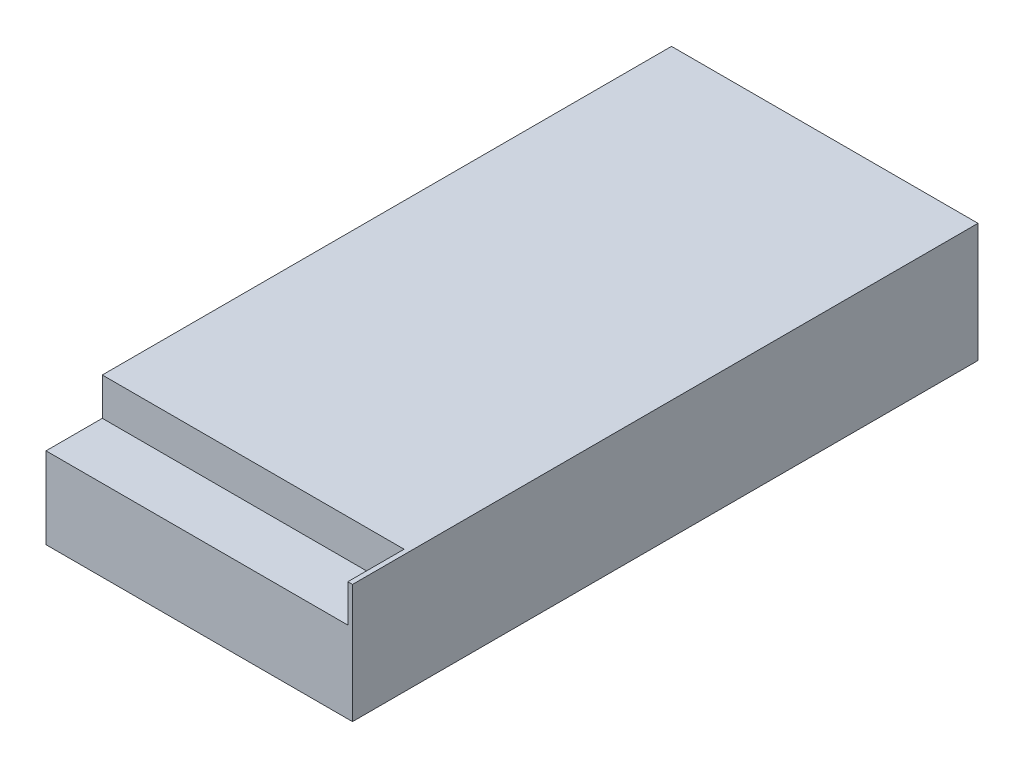
from build123d import *

# Parameters (mm, degrees)
SKETCH_1_W             = 98
SKETCH_1_H             = 200
EXTRUDE_275_DEPTH      = 38
SKETCH_2_W             = 96.5
SKETCH_2_H             = 18
CUT_EXTRUDE_1_DEPTH    = 12
HOLE_WIZARD_M3_1_D     = 2.5
HOLE_WIZARD_M3_1_DEPTH = 5
HOLE_WIZARD_M3_1_TIP   = 0.751075774


with BuildPart() as part:
    # 草图1 → Extrude 275 (new body)
    with BuildSketch(Plane(origin=(0, 0, 0), x_dir=(1, 0, 0), z_dir=(0, 1, 0))):
        Rectangle(SKETCH_1_W, SKETCH_1_H)
    extrude(amount=EXTRUDE_275_DEPTH)

    # 草图2 → 切除-拉伸1 (cut)
    with BuildSketch(Plane(origin=(0, 38, 0), x_dir=(1, 0, 0), z_dir=(0, 1, 0))):
        with Locations((-0.75, -91)):
            Rectangle(SKETCH_2_W, SKETCH_2_H)
    extrude(amount=-CUT_EXTRUDE_1_DEPTH, mode=Mode.SUBTRACT)

    # M3 螺纹孔的螺纹孔钻头1
    with Locations(Plane(origin=(0, 0, 0), x_dir=(-1, 0, 0), z_dir=(0, -1, 0))):
        with Locations((38, -39), (-41, -39), (38, 81), (-41, 81)):
            Hole(HOLE_WIZARD_M3_1_D / 2, depth=HOLE_WIZARD_M3_1_DEPTH)
            with Locations((0, 0, -(HOLE_WIZARD_M3_1_DEPTH + HOLE_WIZARD_M3_1_TIP / 2))):  # 118° drill point
                Cone(0, HOLE_WIZARD_M3_1_D / 2, HOLE_WIZARD_M3_1_TIP, mode=Mode.SUBTRACT)


solid = part.part
